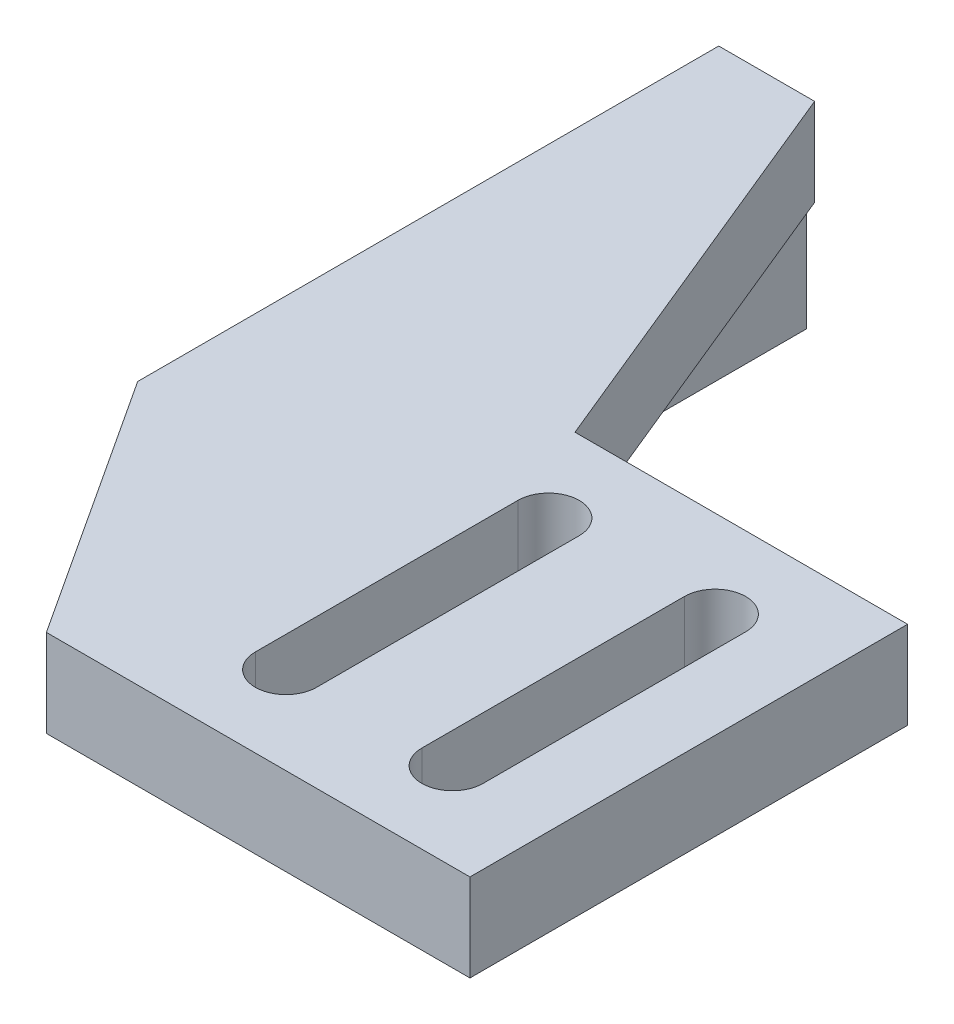
from build123d import *

# Parameters (mm, degrees)
ESTRUSIONE_ESTRUSIONE8_DEPTH = 5
SCHIZZO19_W                  = 5
SCHIZZO19_H                  = 48.212351189
ESTRUSIONE_ESTRUSIONE9_DEPTH = 6.5
SCHIZZO20_R                  = 1.75
TAGLIO_ESTRUSIONE9_DEPTH     = 6
TAGLIO_ESTRUSIONE13_DEPTH    = 21
SCHIZZO26_W                  = 5
SCHIZZO26_H                  = 6.5
TAGLIO_ESTRUSIONE15_DEPTH    = 21


with BuildPart() as part:
    # Schizzo18 → Estrusione-Estrusione8 (new body)
    with BuildSketch(Plane(origin=(0, 40, 0), x_dir=(1, 0, 0), z_dir=(0, 1, 0))):
        Polygon((25, -16), (-9, -16), (-9, 32.212351189), (-3.52472969, 32.212351189), (6, 9), (25, 9), align=None)
        with BuildLine():
            Line((17.25, -11), (17.25, 4))
            ThreePointArc((17.25, 4), (19, 5.75), (20.75, 4))
            Line((20.75, 4), (20.75, -11))
            ThreePointArc((20.75, -11), (19, -12.75), (17.25, -11))
        make_face(mode=Mode.SUBTRACT)
        with BuildLine():
            Line((7.74056589, -11), (7.74056589, 4))
            ThreePointArc((7.74056589, 4), (9.49056589, 5.75), (11.24056589, 4))
            Line((11.24056589, 4), (11.24056589, -11))
            ThreePointArc((11.24056589, -11), (9.49056589, -12.75), (7.74056589, -11))
        make_face(mode=Mode.SUBTRACT)
    extrude(amount=ESTRUSIONE_ESTRUSIONE8_DEPTH)

    # Schizzo19 → Estrusione-Estrusione9 (add)
    with BuildSketch(Plane.XZ.offset(-40)):
        with Locations((-6.5, -8.106175595)):
            Rectangle(SCHIZZO19_W, SCHIZZO19_H)
    extrude(amount=ESTRUSIONE_ESTRUSIONE9_DEPTH)

    # Schizzo20 → Taglio-Estrusione9 (cut)
    with BuildSketch(Plane.ZY.offset(9)):
        with Locations((-19.5, 36.5)):
            Circle(SCHIZZO20_R)
        with Locations((-9.5, 36.5)):
            Circle(SCHIZZO20_R)
    extrude(amount=-TAGLIO_ESTRUSIONE9_DEPTH, mode=Mode.SUBTRACT)

    # Schizzo24 → Taglio-Estrusione13 (cut)
    with BuildSketch(Plane(origin=(0, 45, 0), x_dir=(1, 0, 0), z_dir=(0, 1, 0))):
        Polygon((0.805132443, -16), (-9, -0.979024983), (-9, -16), align=None)
    extrude(amount=-TAGLIO_ESTRUSIONE13_DEPTH, mode=Mode.SUBTRACT)

    # Schizzo26 → Taglio-Estrusione15 (cut)
    with BuildSketch(Plane.XY.offset(0.979024983)):
        with Locations((-6.5, 36.75)):
            Rectangle(SCHIZZO26_W, SCHIZZO26_H)
    extrude(amount=TAGLIO_ESTRUSIONE15_DEPTH, mode=Mode.SUBTRACT)


solid = part.part
